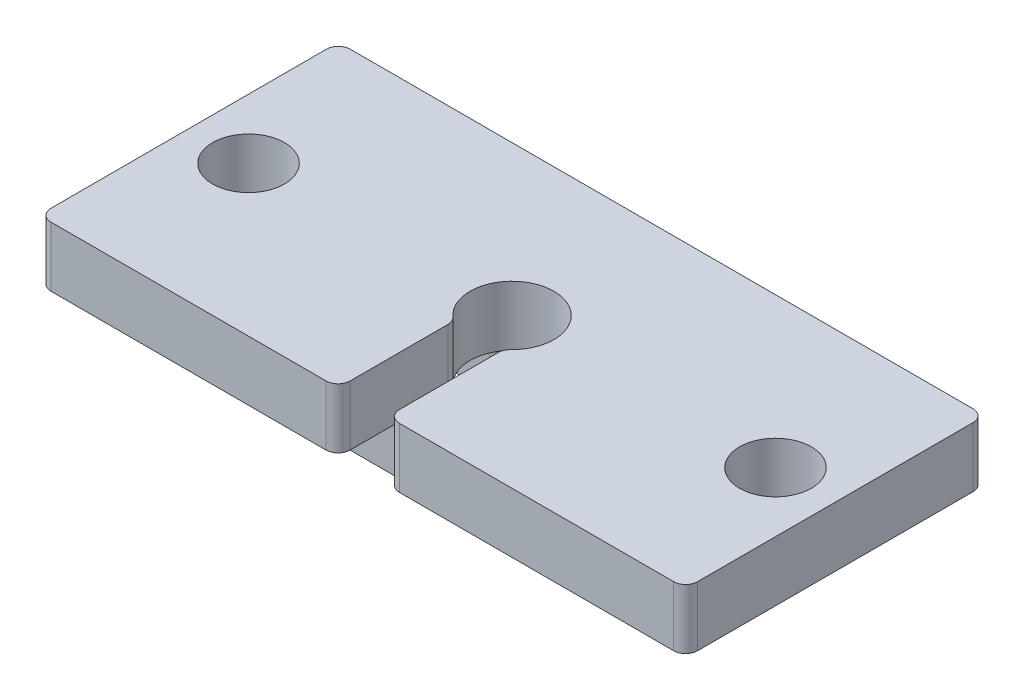
from build123d import *

# Parameters (mm, degrees)
SKETCH1_R           = 3
BOSS_EXTRUDE1_DEPTH = 5
BOSS_EXTRUDE2_DEPTH = 4


with BuildPart() as part:
    # Sketch1 → Boss-Extrude1 (new body)
    with BuildSketch(Plane(origin=(0, 0, 0), x_dir=(1, 0, 0), z_dir=(0, 1, 0))):
        with BuildLine():
            Line((-26.214135995, 14.392719194), (25.785864005, 14.392719194))
            ThreePointArc((25.785864005, 14.392719194), (26.492970786, 14.099825975), (26.785864005, 13.392719194))
            Line((26.785864005, 13.392719194), (26.785864005, -9.607280806))
            ThreePointArc((26.785864005, -9.607280806), (26.492970786, -10.314387587), (25.785864005, -10.607280806))
            Line((25.785864005, -10.607280806), (2.893081301, -10.607280806))
            ThreePointArc((2.893081301, -10.607280806), (2.18597452, -10.314387587), (1.893081301, -9.607280806))
            Line((1.893081301, -9.607280806), (1.893081301, -1.362307791))
            ThreePointArc((1.893081301, -1.362307791), (1.97370849, -0.968920407), (2.202588568, -0.638968461))
            ThreePointArc((2.202588568, -0.638968461), (-0.258950026, 5.392432282), (-2.565241962, -0.700020811))
            ThreePointArc((-2.565241962, -0.700020811), (-2.322726014, -1.035676875), (-2.236986524, -1.440803669))
            Line((-2.236986524, -1.440803669), (-2.236986524, -9.607280806))
            ThreePointArc((-2.236986524, -9.607280806), (-2.529879743, -10.314387587), (-3.236986524, -10.607280806))
            Line((-3.236986524, -10.607280806), (-26.214135995, -10.607280806))
            ThreePointArc((-26.214135995, -10.607280806), (-26.921242776, -10.314387587), (-27.214135995, -9.607280806))
            Line((-27.214135995, -9.607280806), (-27.214135995, 13.392719194))
            ThreePointArc((-27.214135995, 13.392719194), (-26.921242776, 14.099825975), (-26.214135995, 14.392719194))
        make_face()
        with Locations(Location((-22.214135995, 1.892719194, 0), (0, 0, 270))):
            Circle(SKETCH1_R, mode=Mode.SUBTRACT)
        with Locations(Location((21.785864005, 1.892719194, 0), (0, 0, 270))):
            Circle(SKETCH1_R, mode=Mode.SUBTRACT)
    extrude(amount=BOSS_EXTRUDE1_DEPTH)

    # 3DSketch1 → Boss-Extrude2 (add)
    with BuildSketch(Plane(origin=(4.245395627, 0, -4.892719194), x_dir=(-0.9022274497491443, 0, 0.43126051166221485), z_dir=(0, 1, 0))):
        with BuildLine():
            Line((0, 0), (-0.431260512, -0.90222745))
            ThreePointArc((-0.431260512, -0.90222745), (-0.451605977, -1.284369663), (-0.195777043, -1.56897143))
            Line((-0.195777043, -1.56897143), (6.416167911, -4.72945027))
            ThreePointArc((6.416167911, -4.72945027), (6.798310124, -4.749795735), (7.082911891, -4.493966801))
            Line((7.082911891, -4.493966801), (7.514172403, -3.591739351))
            ThreePointArc((7.514172403, -3.591739351), (7.79877417, -3.335910417), (8.180916384, -3.356255882))
            Line((8.180916384, -3.356255882), (19.358269109, -8.698978337))
            ThreePointArc((19.358269109, -8.698978337), (19.482317491, -8.836978321), (19.472452219, -9.022274497))
            Line((19.472452219, -9.022274497), (17.525262711, -13.095932476))
            ThreePointArc((17.525262711, -13.095932476), (17.387262727, -13.219980858), (17.201966551, -13.210115586))
            Line((17.201966551, -13.210115586), (-13.036287471, 1.24362876))
            ThreePointArc((-13.036287471, 1.24362876), (-13.160335853, 1.381628744), (-13.150470581, 1.56692492))
            Line((-13.150470581, 1.56692492), (-11.203281073, 5.640582899))
            ThreePointArc((-11.203281073, 5.640582899), (-11.065281089, 5.764631281), (-10.879984912, 5.754766009))
            Line((-10.879984912, 5.754766009), (-0.235483469, 0.666743981))
            ThreePointArc((-0.235483469, 0.666743981), (0.020345465, 0.382142214), (0, 0))
        make_face()
        with BuildLine():
            Line((-8.723682354, 10.265903258), (2.335421133, 4.979703387))
            ThreePointArc((2.335421133, 4.979703387), (2.717563346, 4.959357922), (3.002165113, 5.215186856))
            Line((3.002165113, 5.215186856), (3.3288691, 5.898674671))
            ThreePointArc((3.3288691, 5.898674671), (3.466869084, 6.022723053), (3.65216526, 6.012857781))
            Line((3.65216526, 6.012857781), (4.690032412, 5.516762124))
            ThreePointArc((4.690032412, 5.516762124), (5.072174626, 5.496416659), (5.356776393, 5.752245593))
            Line((5.356776393, 5.752245593), (6.546001403, 8.240188308))
            ThreePointArc((6.546001403, 8.240188308), (6.555866675, 8.425484484), (6.431818293, 8.563484468))
            Line((6.431818293, 8.563484468), (-6.567379796, 14.777040507))
            ThreePointArc((-6.567379796, 14.777040507), (-6.752675972, 14.786905779), (-6.890675956, 14.662857397))
            Line((-6.890675956, 14.662857397), (-8.837865464, 10.589199418))
            ThreePointArc((-8.837865464, 10.589199418), (-8.847730736, 10.403903241), (-8.723682354, 10.265903258))
        make_face()
        with BuildLine():
            Line((21.837867827, -4.073657979), (23.785057336, 0))
            ThreePointArc((23.785057336, 0), (23.794922608, 0.185296176), (23.670874226, 0.32329616))
            Line((23.670874226, 0.32329616), (10.595558124, 6.573236254))
            ThreePointArc((10.595558124, 6.573236254), (10.410261948, 6.583101526), (10.272261964, 6.459053144))
            Line((10.272261964, 6.459053144), (9.083036954, 3.97111043))
            ThreePointArc((9.083036954, 3.97111043), (9.062691489, 3.588968216), (9.318520423, 3.304366449))
            Line((9.318520423, 3.304366449), (10.432505588, 2.771886738))
            ThreePointArc((10.432505588, 2.771886738), (10.55655397, 2.633886754), (10.546688698, 2.448590577))
            Line((10.546688698, 2.448590577), (10.219984711, 1.765102763))
            ThreePointArc((10.219984711, 1.765102763), (10.199639246, 1.382960549), (10.45546818, 1.098358782))
            Line((10.45546818, 1.098358782), (21.514571667, -4.187841089))
            ThreePointArc((21.514571667, -4.187841089), (21.699867844, -4.197706361), (21.837867827, -4.073657979))
        make_face()
    extrude(amount=-BOSS_EXTRUDE2_DEPTH)


solid = part.part
